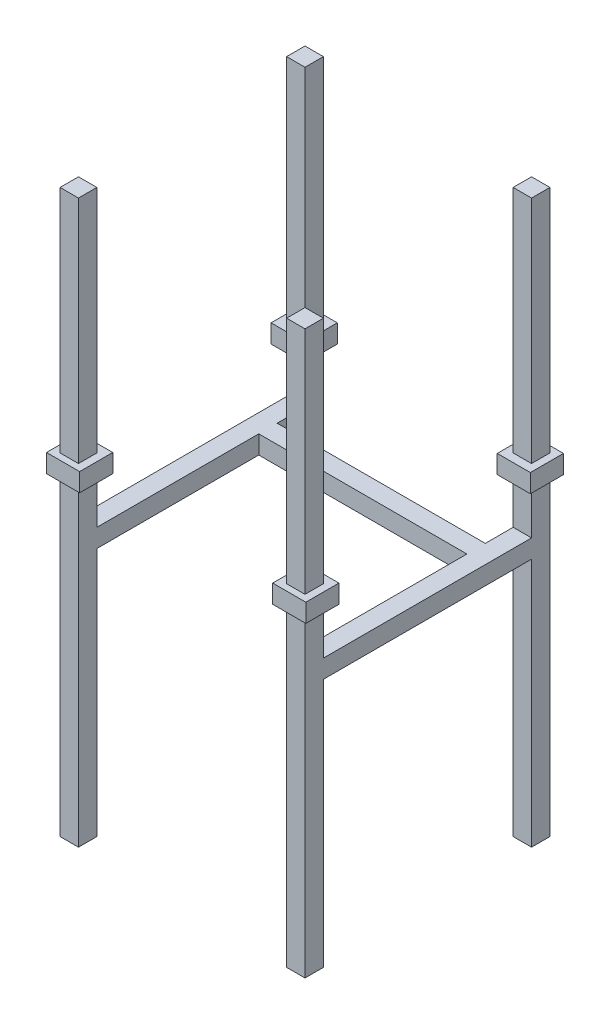
from build123d import *

# Parameters (mm, degrees)
CROQUIS1_W                = 50
CROQUIS1_H                = 50
SALIENTE_EXTRUIR1_DEPTH   = 625
SALIENTE_EXTRUIR1_2_DEPTH = 625
SALIENTE_EXTRUIR1_3_DEPTH = 625
SALIENTE_EXTRUIR1_4_DEPTH = 625
CROQUIS2_W                = 90
CROQUIS2_H                = 90
SALIENTE_EXTRUIR2_DEPTH   = 50
CROQUIS4_W                = 50
CROQUIS4_H                = 50
SALIENTE_EXTRUIR3_DEPTH   = 853
SALIENTE_EXTRUIR4_DEPTH   = 50


with BuildPart() as part:
    # Croquis1 → Saliente-Extruir1 (new body)
    with BuildSketch(Plane(origin=(0, 0, 0), x_dir=(1, 0, 0), z_dir=(0, 1, 0))):
        with Locations((-307.842712475, 307.842712475)):
            Rectangle(CROQUIS1_W, CROQUIS1_H)
    extrude(amount=-SALIENTE_EXTRUIR1_DEPTH)



with BuildPart() as body_2:
    # Croquis1 → Saliente-Extruir1 2 (new body)
    with BuildSketch(Plane(origin=(0, 0, 0), x_dir=(1, 0, 0), z_dir=(0, 1, 0))):
        with Locations((307.842712475, 307.842712475)):
            Rectangle(CROQUIS1_W, CROQUIS1_H)
    extrude(amount=-SALIENTE_EXTRUIR1_2_DEPTH)


with BuildPart() as body_3:
    # Croquis1 → Saliente-Extruir1 3 (new body)
    with BuildSketch(Plane(origin=(0, 0, 0), x_dir=(1, 0, 0), z_dir=(0, 1, 0))):
        with Locations((-307.842712475, -307.842712475)):
            Rectangle(CROQUIS1_W, CROQUIS1_H)
    extrude(amount=-SALIENTE_EXTRUIR1_3_DEPTH)


with BuildPart() as body_4:
    # Croquis1 → Saliente-Extruir1 4 (new body)
    with BuildSketch(Plane(origin=(0, 0, 0), x_dir=(1, 0, 0), z_dir=(0, 1, 0))):
        with Locations((307.842712475, -307.842712475)):
            Rectangle(CROQUIS1_W, CROQUIS1_H)
    extrude(amount=-SALIENTE_EXTRUIR1_4_DEPTH)


with BuildPart() as part_1:
    add(part.part)

    add(body_2.part)  # Saliente-Extruir2 merges body 2

    add(body_3.part)  # Saliente-Extruir2 merges body 3

    add(body_4.part)  # Saliente-Extruir2 merges body 4
    # Croquis2 → Saliente-Extruir2 (add)
    with BuildSketch(Plane.XZ.offset(625)):
        with Locations((-307.360997504, 305.1451107)):
            Rectangle(CROQUIS2_W, CROQUIS2_H)
        with Locations((307.360997504, 305.1451107)):
            Rectangle(CROQUIS2_W, CROQUIS2_H)
        with Locations((307.360997504, -305.1451107)):
            Rectangle(CROQUIS2_W, CROQUIS2_H)
        with Locations((-307.360997504, -305.1451107)):
            Rectangle(CROQUIS2_W, CROQUIS2_H)
    extrude(amount=SALIENTE_EXTRUIR2_DEPTH)

    # Croquis4 → Saliente-Extruir3 (add)
    with BuildSketch(Plane.XZ.offset(675)):
        with Locations((-307.842712475, 307.842712475)):
            Rectangle(CROQUIS4_W, CROQUIS4_H)
        with Locations((-307.842712475, -307.842712475)):
            Rectangle(CROQUIS4_W, CROQUIS4_H)
        with Locations((307.842712475, 307.842712475)):
            Rectangle(CROQUIS4_W, CROQUIS4_H)
        with Locations((307.842712475, -307.842712475)):
            Rectangle(CROQUIS4_W, CROQUIS4_H)
    extrude(amount=SALIENTE_EXTRUIR3_DEPTH)

    # Croquis6 → Saliente-Extruir4 (add)
    with BuildSketch(Plane(origin=(0, -800, 0), x_dir=(1, 0, 0), z_dir=(0, 1, 0))):
        Polygon((332.842712475, 282.842712475), (332.842712475, -332.842712475), (282.842712475, -332.842712475), (282.842712475, -282.842712475), (282.842712475, 157.157287525), (-282.842712475, 157.157287525), (-282.842712475, -282.842712475), (-282.842712475, -332.842712475), (-332.842712475, -332.842712475), (-332.842712475, 282.842712475), (-282.842712475, 282.842712475), (-282.842712475, 207.157287525), (282.842712475, 207.157287525), (282.842712475, 282.842712475), align=None)
    extrude(amount=-SALIENTE_EXTRUIR4_DEPTH)


solid = part_1.part
